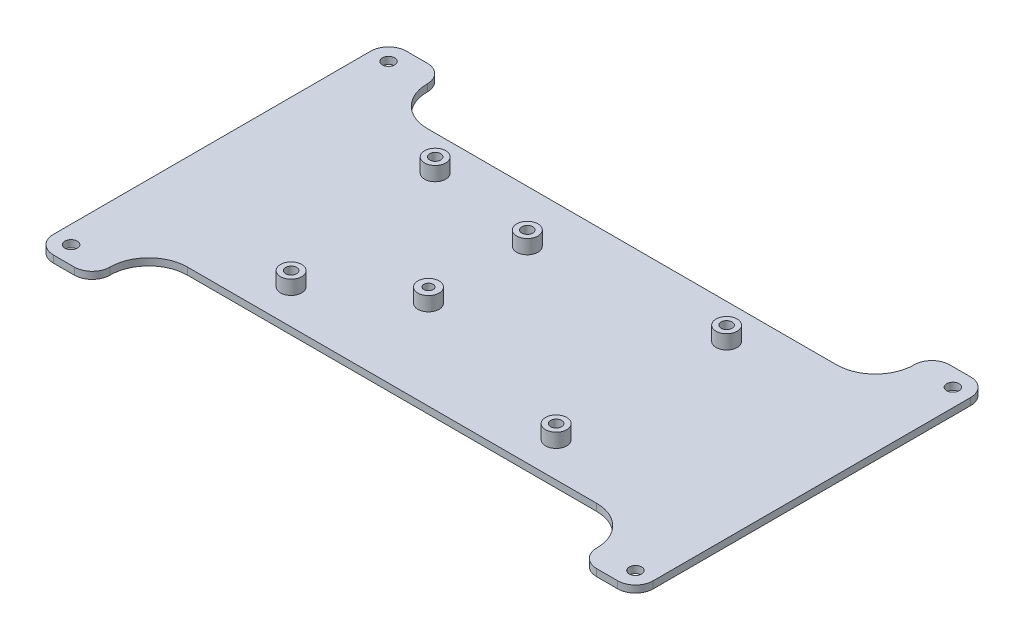
from build123d import *

# Parameters (mm, degrees)
ESQUISSE1_R             = 1.75
BOSS_EXTRU_1_DEPTH      = 2
ESQUISSE2_R             = 3
ESQUISSE2_R_2           = 1.5621
ESQUISSE2_R_3           = 1.315256363
BOSS_EXTRU_2_DEPTH      = 4
ENL_V_START             = -4
ESQUISSE4_R             = 1.5621
ESQUISSE4_R_2           = 1.315256363
ENL_V_MAT_EXTRU_1_DEPTH = 4


with BuildPart() as part:
    # Esquisse1 → Boss.-Extru.1 (new body)
    with BuildSketch(Plane(origin=(0, 0, 0), x_dir=(1, 0, 0), z_dir=(0, 1, 0))):
        with BuildLine():
            Line((80, 50.039706632), (74.039706632, 50.039706632))
            ThreePointArc((74.039706632, 50.039706632), (70.476095897, 48.563610735), (69, 45))
            ThreePointArc((69, 45), (65.778174593, 37.221825407), (58, 34))
            Line((58, 34), (-58, 34))
            ThreePointArc((-58, 34), (-65.778174593, 37.221825407), (-69, 45))
            ThreePointArc((-69, 45), (-70.476095897, 48.563610735), (-74.039706632, 50.039706632))
            Line((-74.039706632, 50.039706632), (-80, 50.039706632))
            ThreePointArc((-80, 50.039706632), (-83.563610735, 48.563610735), (-85.039706632, 45))
            Line((-85.039706632, 45), (-85.039706632, -45))
            ThreePointArc((-85.039706632, -45), (-83.563610735, -48.563610735), (-80, -50.039706632))
            Line((-80, -50.039706632), (-74.039706632, -50.039706632))
            ThreePointArc((-74.039706632, -50.039706632), (-70.476095897, -48.563610735), (-69, -45))
            ThreePointArc((-69, -45), (-65.778174593, -37.221825407), (-58, -34))
            Line((-58, -34), (58, -34))
            ThreePointArc((58, -34), (65.778174593, -37.221825407), (69, -45))
            ThreePointArc((69, -45), (70.476095897, -48.563610735), (74.039706632, -50.039706632))
            Line((74.039706632, -50.039706632), (80, -50.039706632))
            ThreePointArc((80, -50.039706632), (83.563610735, -48.563610735), (85.039706632, -45))
            Line((85.039706632, -45), (85.039706632, 45))
            ThreePointArc((85.039706632, 45), (83.563610735, 48.563610735), (80, 50.039706632))
        make_face()
        with Locations(Location((-80, -45, 0), (0, 0, 270))):
            Circle(ESQUISSE1_R, mode=Mode.SUBTRACT)
        with Locations(Location((-80, 45, 0), (0, 0, 270))):
            Circle(ESQUISSE1_R, mode=Mode.SUBTRACT)
        with Locations(Location((80, -45, 0), (0, 0, 270))):
            Circle(ESQUISSE1_R, mode=Mode.SUBTRACT)
        with Locations(Location((80, 45, 0), (0, 0, 270))):
            Circle(ESQUISSE1_R, mode=Mode.SUBTRACT)
    extrude(amount=BOSS_EXTRU_1_DEPTH)

    # Esquisse2 → Boss.-Extru.2 (add)
    # profile 1 of 6: a face of its own
    with BuildSketch(Plane(origin=(0, 2, 0), x_dir=(1, 0, 0), z_dir=(0, 1, 0))):
        with Locations(Location((-14.9479, 19.291507234, 0), (0, 0, 270))):
            Circle(ESQUISSE2_R)
        with Locations(Location((-14.9479, 19.291507234, 0), (0, 0, 270))):
            Circle(ESQUISSE2_R_2, mode=Mode.SUBTRACT)
    # profile 2 of 6: a face of its own
    with BuildSketch(Plane(origin=(0, 2, 0), x_dir=(1, 0, 0), z_dir=(0, 1, 0))):
        with Locations(Location((-14.9479, -8.724692766, 0), (0, 0, 270))):
            Circle(ESQUISSE2_R)
        with Locations(Location((-14.9479, -8.724692766, 0), (0, 0, 270))):
            Circle(ESQUISSE2_R_3, mode=Mode.SUBTRACT)
    # profile 3 of 6: a face of its own
    with BuildSketch(Plane(origin=(0, 2, 0), x_dir=(1, 0, 0), z_dir=(0, 1, 0))):
        with Locations(Location((-38.4556, -24.1662, 0), (0, 0, 270))):
            Circle(ESQUISSE2_R)
        with Locations(Location((-38.4556, -24.1662, 0), (0, 0, 270))):
            Circle(ESQUISSE2_R_2, mode=Mode.SUBTRACT)
    # profile 4 of 6: a face of its own
    with BuildSketch(Plane(origin=(0, 2, 0), x_dir=(1, 0, 0), z_dir=(0, 1, 0))):
        with Locations(Location((36.6776, -24.1662, 0), (0, 0, 270))):
            Circle(ESQUISSE2_R)
        with Locations(Location((36.6776, -24.1662, 0), (0, 0, 270))):
            Circle(ESQUISSE2_R_2, mode=Mode.SUBTRACT)
    # profile 5 of 6: a face of its own
    with BuildSketch(Plane(origin=(0, 2, 0), x_dir=(1, 0, 0), z_dir=(0, 1, 0))):
        with Locations(Location((36.6776, 24.17, 0), (0, 0, 270))):
            Circle(ESQUISSE2_R)
        with Locations(Location((36.6776, 24.17, 0), (0, 0, 270))):
            Circle(ESQUISSE2_R_2, mode=Mode.SUBTRACT)
    # profile 6 of 6: a face of its own
    with BuildSketch(Plane(origin=(0, 2, 0), x_dir=(1, 0, 0), z_dir=(0, 1, 0))):
        with Locations(Location((-45.9486, 24.17, 0), (0, 0, 270))):
            Circle(ESQUISSE2_R)
        with Locations(Location((-45.9486, 24.17, 0), (0, 0, 270))):
            Circle(ESQUISSE2_R_2, mode=Mode.SUBTRACT)
    extrude(amount=BOSS_EXTRU_2_DEPTH)

    # Esquisse4 → Enlèv. mat.-Extru.1 (cut)
    with BuildSketch(Plane(origin=(0, 2, 0), x_dir=(1, 0, 0), z_dir=(0, 1, 0)).offset(ENL_V_START)):
        with Locations(Location((-45.9486, 24.17, 0), (0, 0, 270))):
            Circle(ESQUISSE4_R)
        with Locations(Location((-14.9479, 19.291507234, 0), (0, 0, 270))):
            Circle(ESQUISSE4_R)
        with Locations(Location((36.6776, 24.17, 0), (0, 0, 270))):
            Circle(ESQUISSE4_R)
        with Locations(Location((36.6776, -24.1662, 0), (0, 0, 270))):
            Circle(ESQUISSE4_R)
        with Locations(Location((-14.9479, -8.724692766, 0), (0, 0, 270))):
            Circle(ESQUISSE4_R_2)
        with Locations(Location((-38.4556, -24.1662, 0), (0, 0, 270))):
            Circle(ESQUISSE4_R)
    extrude(amount=ENL_V_MAT_EXTRU_1_DEPTH, mode=Mode.SUBTRACT)


solid = part.part
